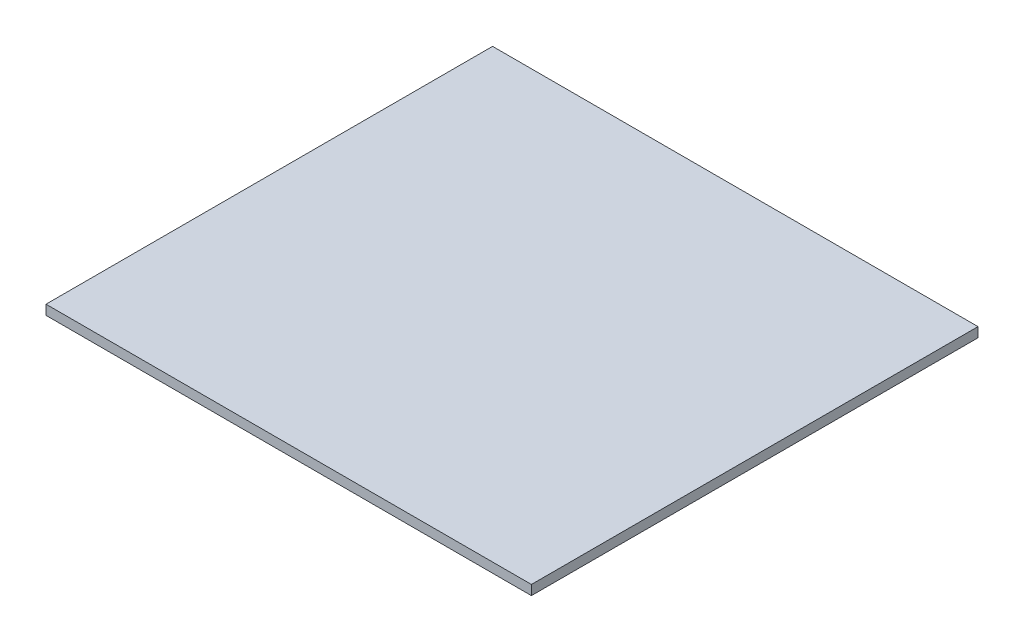
from build123d import *

# Parameters (mm, degrees)
SKETCH1_W           = 250
SKETCH1_H           = 230
BOSS_EXTRUDE1_DEPTH = 5


with BuildPart() as part:
    # Sketch1 → Boss-Extrude1 (new body)
    with BuildSketch(Plane(origin=(0, 0, 0), x_dir=(1, 0, 0), z_dir=(0, 1, 0))):
        Rectangle(SKETCH1_W, SKETCH1_H)
    extrude(amount=BOSS_EXTRUDE1_DEPTH)


solid = part.part
